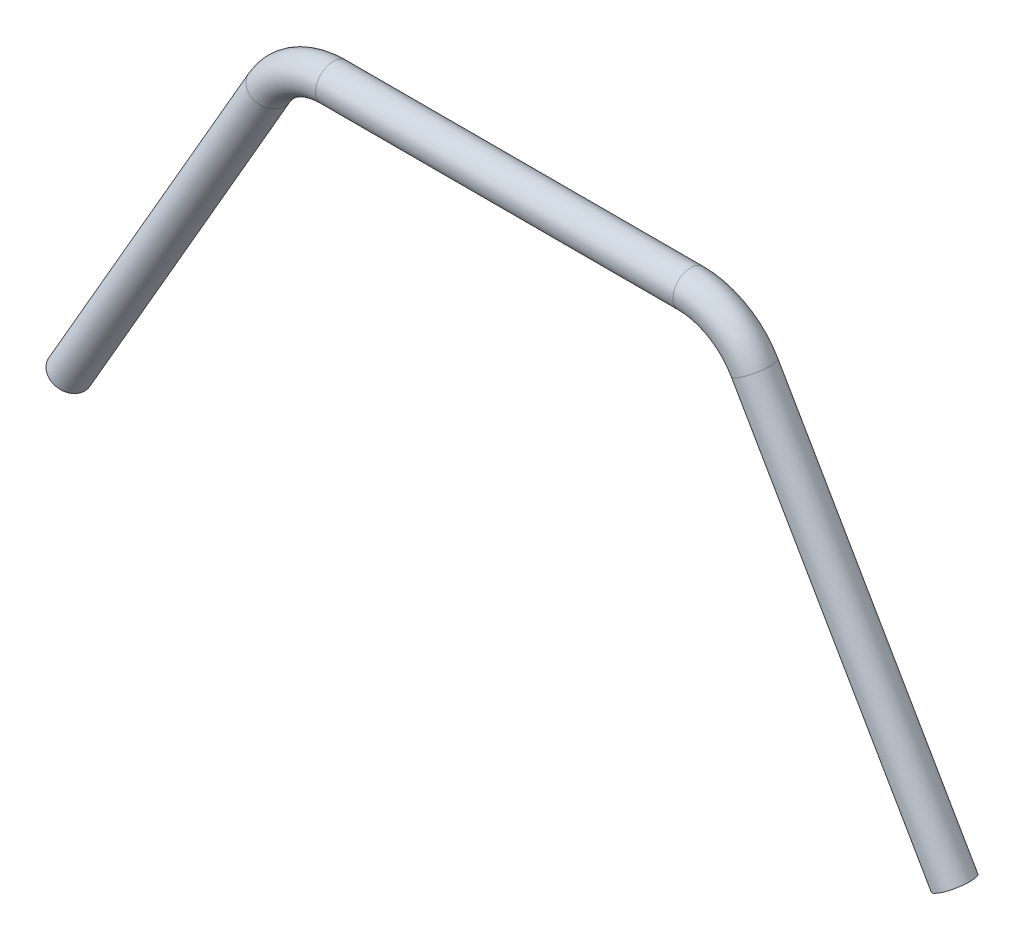
from build123d import *

# Parameters (mm, degrees)
SKETCH_1_R = 6


with BuildPart() as part:
    # По траектории1: sweep along a path in Эскиз2
    with BuildLine(Plane.XY) as sweep_1_path:
        Line((0, -6), (60.56624327, -6))
        ThreePointArc((60.56624327, -6), (73.06624327, -9.349364905), (82.216878365, -18.5))
        Line((82.216878365, -18.5), (150, -135.903810568))
    # Эскиз1 → По траектории1 (sweep)
    with BuildSketch(Plane(origin=(0, 0, 0), x_dir=(0, 0, -1), z_dir=(1, 0, 0))):
        with Locations((0, -6)):
            Circle(SKETCH_1_R)
    sweep_1 = sweep(path=sweep_1_path.line)

    # Зеркальное отражение1: По траектории1 across plane
    add(sweep_1.mirror(Plane(origin=(0, -6, 0), x_dir=(0, 0, 1), z_dir=(1, 0, 0))))


solid = part.part
